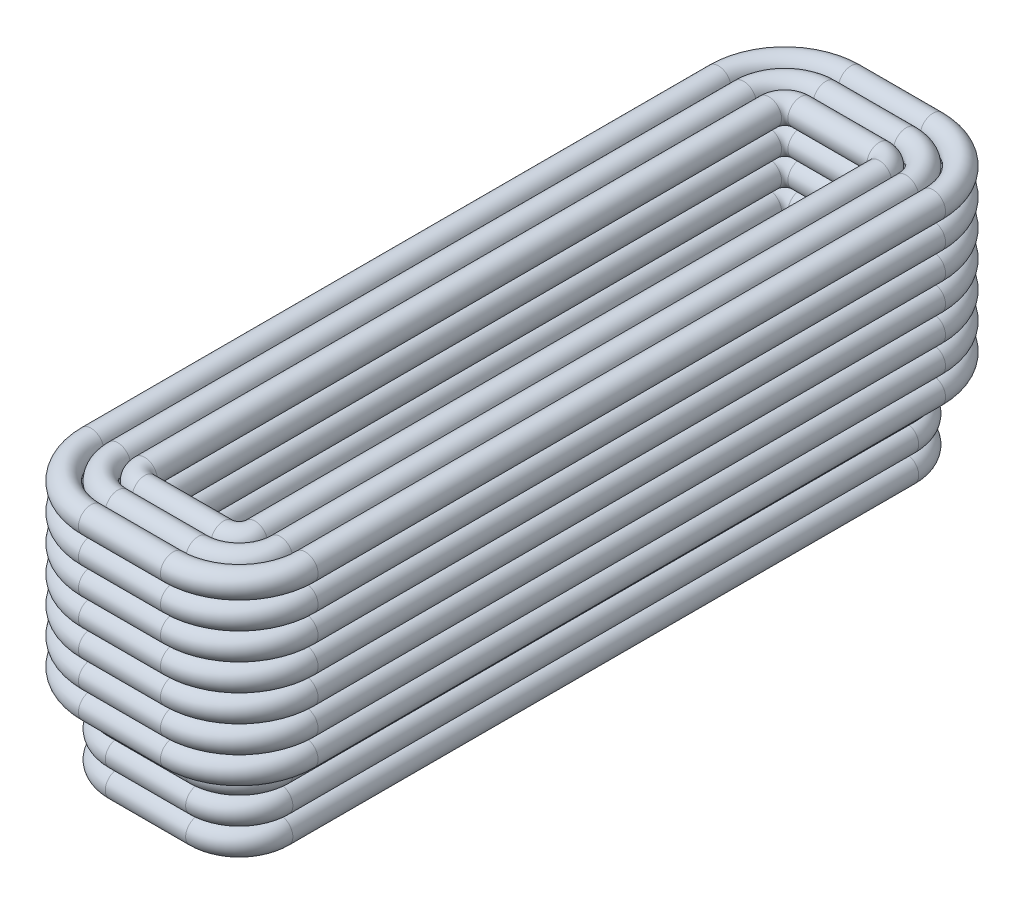
from build123d import *

# Parameters (mm, degrees)
SWEEP1_PROFILE_R = 0.4
SWEEP2_PROFILE_R = 0.4
LPATTERN1_COUNT  = 10
LPATTERN1_PITCH  = 0.85
SWEEP3_PROFILE_R = 0.4
LPATTERN3_COUNT  = 7
LPATTERN3_PITCH  = 0.85


with BuildPart() as part:
    # Sweep1: sweep along a path in Sketch2
    with BuildLine(Plane(origin=(0, 41.12076696888202, 0), x_dir=(1, 0, 0), z_dir=(0, 1, 0))) as sweep1_path:
        Line((-1.2499999999999998, -20.399999999999995), (1.2500000000000004, -20.399999999999995))
        ThreePointArc((1.2500000000000004, -20.399999999999995), (1.6035533905932717, -20.253553390593268), (1.75, -19.9))
        Line((1.75, -19.9), (1.7500000000000002, -0.09999999999999896))
        ThreePointArc((1.7500000000000002, -0.09999999999999896), (1.603553390593274, 0.25355339059327475), (1.2500000000000002, 0.400000000000001))
        Line((1.2500000000000002, 0.400000000000001), (-1.2499999999999998, 0.400000000000001))
        ThreePointArc((-1.2499999999999998, 0.400000000000001), (-1.6035533905932735, 0.2535533905932748), (-1.7499999999999998, -0.09999999999999896))
        Line((-1.7499999999999998, -0.09999999999999896), (-1.7499999999999998, -19.9))
        ThreePointArc((-1.7499999999999998, -19.9), (-1.603553390593271, -20.253553390593268), (-1.2499999999999998, -20.399999999999995))
    # Sweep1 profile (on start of the path) → Sweep1 (sweep)
    with BuildSketch(Plane(origin=(-1.2499999999999998, 41.12076696888202, 20.399999999999995), x_dir=(0, 0, 1), z_dir=(1, 0, 0))):
        Circle(SWEEP1_PROFILE_R)
    sweep(path=sweep1_path.line)


with BuildPart() as body_2:
    # Sweep2: sweep along a path in Sketch4
    with BuildLine(Plane(origin=(0, 41.12076696888202, 0), x_dir=(1, 0, 0), z_dir=(0, 1, 0))) as sweep2_path:
        Line((-1.275000000000002, 1.2250000000000003), (1.2749999999999984, 1.2250000000000003))
        ThreePointArc((1.2749999999999984, 1.2250000000000003), (2.19423881554251, 0.8442388155425122), (2.574999999999999, -0.07499999999999939))
        Line((2.574999999999999, -0.07499999999999939), (2.575000000000001, -19.924999999999997))
        ThreePointArc((2.575000000000001, -19.924999999999997), (2.1942388155425108, -20.844238815542507), (1.275000000000001, -21.224999999999994))
        Line((1.275000000000001, -21.224999999999994), (-1.2749999999999995, -21.224999999999994))
        ThreePointArc((-1.2749999999999995, -21.224999999999994), (-2.194238815542511, -20.844238815542507), (-2.5749999999999993, -19.924999999999997))
        Line((-2.5749999999999993, -19.924999999999997), (-2.575000000000002, -0.0749999999999997))
        ThreePointArc((-2.575000000000002, -0.0749999999999997), (-2.1942388155425134, 0.8442388155425122), (-1.275000000000002, 1.2250000000000003))
    # Sweep2 profile (on start of the path) → Sweep2 (sweep)
    with BuildSketch(Plane(origin=(-1.275000000000002, 41.12076696888202, -1.2250000000000003), x_dir=(0, 0, 1), z_dir=(1, 0, 0))):
        Circle(SWEEP2_PROFILE_R)
    sweep(path=sweep2_path.line)


with BuildPart() as lpattern1_1:
    # LPattern1: pattern copy
    add(body_2.part.moved(Location(Vector(0, 1, 0) * (1 * LPATTERN1_PITCH))))


with BuildPart() as lpattern1_2:
    # LPattern1: pattern copy
    add(body_2.part.moved(Location(Vector(0, 1, 0) * (2 * LPATTERN1_PITCH))))


with BuildPart() as lpattern1_3:
    # LPattern1: pattern copy
    add(body_2.part.moved(Location(Vector(0, 1, 0) * (3 * LPATTERN1_PITCH))))


with BuildPart() as lpattern1_4:
    # LPattern1: pattern copy
    add(body_2.part.moved(Location(Vector(0, 1, 0) * (4 * LPATTERN1_PITCH))))


with BuildPart() as lpattern1_5:
    # LPattern1: pattern copy
    add(body_2.part.moved(Location(Vector(0, 1, 0) * (5 * LPATTERN1_PITCH))))


with BuildPart() as lpattern1_6:
    # LPattern1: pattern copy
    add(body_2.part.moved(Location(Vector(0, 1, 0) * (6 * LPATTERN1_PITCH))))


with BuildPart() as lpattern1_7:
    # LPattern1: pattern copy
    add(body_2.part.moved(Location(Vector(0, 1, 0) * (7 * LPATTERN1_PITCH))))


with BuildPart() as lpattern1_8:
    # LPattern1: pattern copy
    add(body_2.part.moved(Location(Vector(0, 1, 0) * (8 * LPATTERN1_PITCH))))


with BuildPart() as lpattern1_9:
    # LPattern1: pattern copy
    add(body_2.part.moved(Location(Vector(0, 1, 0) * (9 * LPATTERN1_PITCH))))


with BuildPart() as lpattern1_10:
    # LPattern1: pattern copy
    add(part.part.moved(Location(Vector(0, 1, 0) * (1 * LPATTERN1_PITCH))))


with BuildPart() as lpattern1_11:
    # LPattern1: pattern copy
    add(part.part.moved(Location(Vector(0, 1, 0) * (2 * LPATTERN1_PITCH))))


with BuildPart() as lpattern1_12:
    # LPattern1: pattern copy
    add(part.part.moved(Location(Vector(0, 1, 0) * (3 * LPATTERN1_PITCH))))


with BuildPart() as lpattern1_13:
    # LPattern1: pattern copy
    add(part.part.moved(Location(Vector(0, 1, 0) * (4 * LPATTERN1_PITCH))))


with BuildPart() as lpattern1_14:
    # LPattern1: pattern copy
    add(part.part.moved(Location(Vector(0, 1, 0) * (5 * LPATTERN1_PITCH))))


with BuildPart() as lpattern1_15:
    # LPattern1: pattern copy
    add(part.part.moved(Location(Vector(0, 1, 0) * (6 * LPATTERN1_PITCH))))


with BuildPart() as lpattern1_16:
    # LPattern1: pattern copy
    add(part.part.moved(Location(Vector(0, 1, 0) * (7 * LPATTERN1_PITCH))))


with BuildPart() as lpattern1_17:
    # LPattern1: pattern copy
    add(part.part.moved(Location(Vector(0, 1, 0) * (8 * LPATTERN1_PITCH))))


with BuildPart() as lpattern1_18:
    # LPattern1: pattern copy
    add(part.part.moved(Location(Vector(0, 1, 0) * (9 * LPATTERN1_PITCH))))


with BuildPart() as body_21:
    # Sweep3: sweep along a path in Sketch351
    with BuildLine(Plane(origin=(0, 48.77076696888202, 0), x_dir=(1, 0, 0), z_dir=(0, 1, 0))) as sweep3_path:
        Line((-1.3, -22.05), (1.2999999999999992, -22.05))
        ThreePointArc((1.2999999999999992, -22.05), (2.7849242404917525, -21.43492424049175), (3.399999999999999, -19.949999999999996))
        Line((3.399999999999999, -19.949999999999996), (3.399999999999999, -0.04999999999999883))
        ThreePointArc((3.399999999999999, -0.04999999999999883), (2.7849242404917494, 1.4349242404917508), (1.2999999999999992, 2.050000000000001))
        Line((1.2999999999999992, 2.050000000000001), (-1.3, 2.050000000000001))
        ThreePointArc((-1.3, 2.050000000000001), (-2.7849242404917494, 1.4349242404917508), (-3.4, -0.04999999999999883))
        Line((-3.4, -0.04999999999999883), (-3.4, -19.949999999999996))
        ThreePointArc((-3.4, -19.949999999999996), (-2.784924240491753, -21.43492424049175), (-1.3, -22.05))
    # Sweep3 profile (on start of the path) → Sweep3 (sweep)
    with BuildSketch(Plane(origin=(-1.3, 48.77076696888202, 22.05), x_dir=(0, 0, 1), z_dir=(1, 0, 0))):
        Circle(SWEEP3_PROFILE_R)
    sweep(path=sweep3_path.line)


with BuildPart() as lpattern3_1:
    # LPattern3: pattern copy
    add(body_21.part.moved(Location(Vector(0, -1, 0) * (1 * LPATTERN3_PITCH))))


with BuildPart() as lpattern3_2:
    # LPattern3: pattern copy
    add(body_21.part.moved(Location(Vector(0, -1, 0) * (2 * LPATTERN3_PITCH))))


with BuildPart() as lpattern3_3:
    # LPattern3: pattern copy
    add(body_21.part.moved(Location(Vector(0, -1, 0) * (3 * LPATTERN3_PITCH))))


with BuildPart() as lpattern3_4:
    # LPattern3: pattern copy
    add(body_21.part.moved(Location(Vector(0, -1, 0) * (4 * LPATTERN3_PITCH))))


with BuildPart() as lpattern3_5:
    # LPattern3: pattern copy
    add(body_21.part.moved(Location(Vector(0, -1, 0) * (5 * LPATTERN3_PITCH))))


with BuildPart() as lpattern3_6:
    # LPattern3: pattern copy
    add(body_21.part.moved(Location(Vector(0, -1, 0) * (6 * LPATTERN3_PITCH))))


solid = Compound([part.part, body_2.part, lpattern1_1.part, lpattern1_2.part, lpattern1_3.part, lpattern1_4.part, lpattern1_5.part, lpattern1_6.part, lpattern1_7.part, lpattern1_8.part, lpattern1_9.part, lpattern1_10.part, lpattern1_11.part, lpattern1_12.part, lpattern1_13.part, lpattern1_14.part, lpattern1_15.part, lpattern1_16.part, lpattern1_17.part, lpattern1_18.part, body_21.part, lpattern3_1.part, lpattern3_2.part, lpattern3_3.part, lpattern3_4.part, lpattern3_5.part, lpattern3_6.part])
